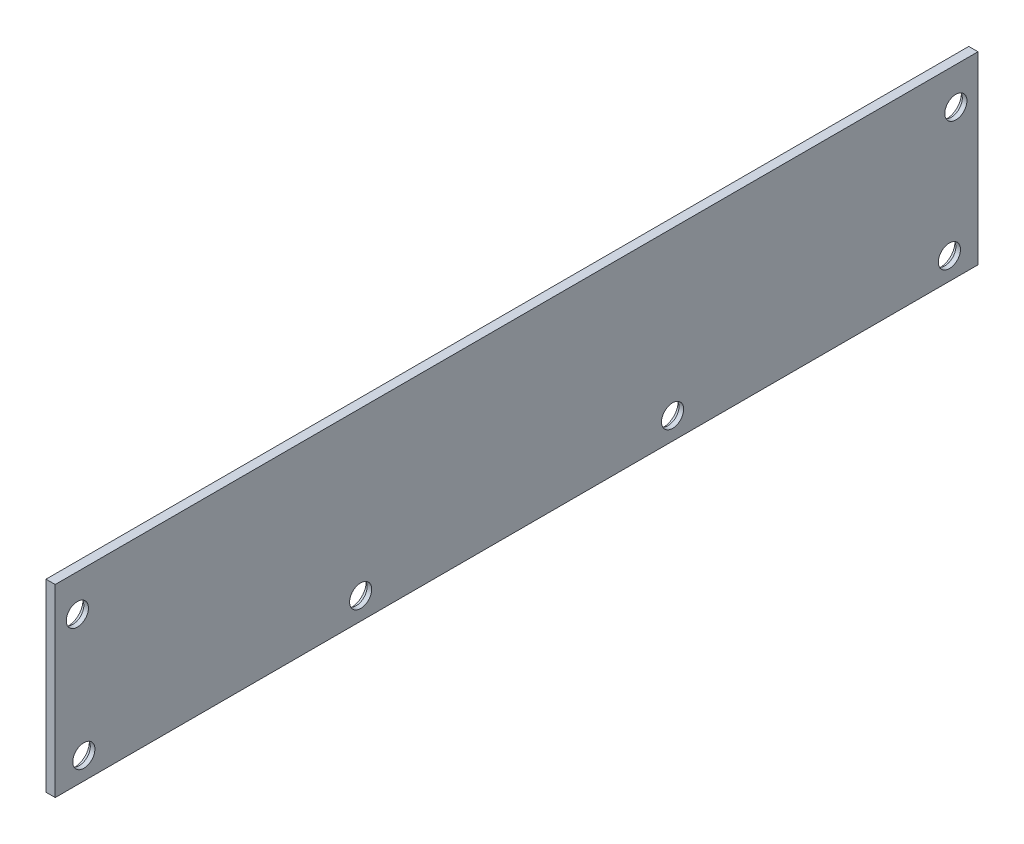
from build123d import *

# Parameters (mm, degrees)
SKETCH3_W           = 1.27
SKETCH3_H           = 25.4
BOSS_EXTRUDE1_DEPTH = 127
SKETCH5_R           = 1.524
CUT_EXTRUDE1_DEPTH  = 1.27
SKETCH6_R           = 2.032
SKETCH6_R_2         = 1.524
CUT_EXTRUDE3_DEPTH  = 0.635


with BuildPart() as part:
    # Sketch3 → Boss-Extrude1 (new body)
    with BuildSketch(Plane.XY):
        with Locations((0, -12.7)):
            Rectangle(SKETCH3_W, SKETCH3_H)
    extrude(amount=-BOSS_EXTRUDE1_DEPTH)

    # Sketch5 → Cut-Extrude1 (cut)
    with BuildSketch(Plane.ZY.offset(0.635)):
        with Locations(Location((-123.063, -22.352, 0), (0, 0, 270))):
            Circle(SKETCH5_R)
        with Locations(Location((-84.963, -22.352, 0), (0, 0, 270))):
            Circle(SKETCH5_R)
        with Locations(Location((-123.952, -5.08, 0), (0, 0, 270))):
            Circle(SKETCH5_R)
        with Locations(Location((-42.037, -22.352, 0), (0, 0, 90))):
            Circle(SKETCH5_R)
        with Locations(Location((-3.937, -22.352, 0), (0, 0, 90))):
            Circle(SKETCH5_R)
        with Locations(Location((-3.048, -5.08, 0), (0, 0, 90))):
            Circle(SKETCH5_R)
    extrude(amount=-CUT_EXTRUDE1_DEPTH, mode=Mode.SUBTRACT)

    # Sketch6 → Cut-Extrude3 (cut)
    # profile 1 of 6: a face of its own
    with BuildSketch(Plane.ZY.offset(0.635)):
        with Locations(Location((-123.063, -22.352, 0), (0, 0, 270))):
            Circle(SKETCH6_R)
        with Locations(Location((-123.063, -22.352, 0), (0, 0, 270))):
            Circle(SKETCH6_R_2, mode=Mode.SUBTRACT)
    # profile 2 of 6: a face of its own
    with BuildSketch(Plane.ZY.offset(0.635)):
        with Locations(Location((-84.963, -22.352, 0), (0, 0, 270))):
            Circle(SKETCH6_R)
        with Locations(Location((-84.963, -22.352, 0), (0, 0, 270))):
            Circle(SKETCH6_R_2, mode=Mode.SUBTRACT)
    # profile 3 of 6: a face of its own
    with BuildSketch(Plane.ZY.offset(0.635)):
        with Locations(Location((-42.037, -22.352, 0), (0, 0, 270))):
            Circle(SKETCH6_R)
        with Locations(Location((-42.037, -22.352, 0), (0, 0, 270))):
            Circle(SKETCH6_R_2, mode=Mode.SUBTRACT)
    # profile 4 of 6: a face of its own
    with BuildSketch(Plane.ZY.offset(0.635)):
        with Locations(Location((-3.937, -22.352, 0), (0, 0, 270))):
            Circle(SKETCH6_R)
        with Locations(Location((-3.937, -22.352, 0), (0, 0, 270))):
            Circle(SKETCH6_R_2, mode=Mode.SUBTRACT)
    # profile 5 of 6: a face of its own
    with BuildSketch(Plane.ZY.offset(0.635)):
        with Locations(Location((-3.048, -5.08, 0), (0, 0, 270))):
            Circle(SKETCH6_R)
        with Locations(Location((-3.048, -5.08, 0), (0, 0, 270))):
            Circle(SKETCH6_R_2, mode=Mode.SUBTRACT)
    # profile 6 of 6: a face of its own
    with BuildSketch(Plane.ZY.offset(0.635)):
        with Locations(Location((-123.952, -5.08, 0), (0, 0, 270))):
            Circle(SKETCH6_R)
    extrude(amount=-CUT_EXTRUDE3_DEPTH, mode=Mode.SUBTRACT)


solid = part.part
